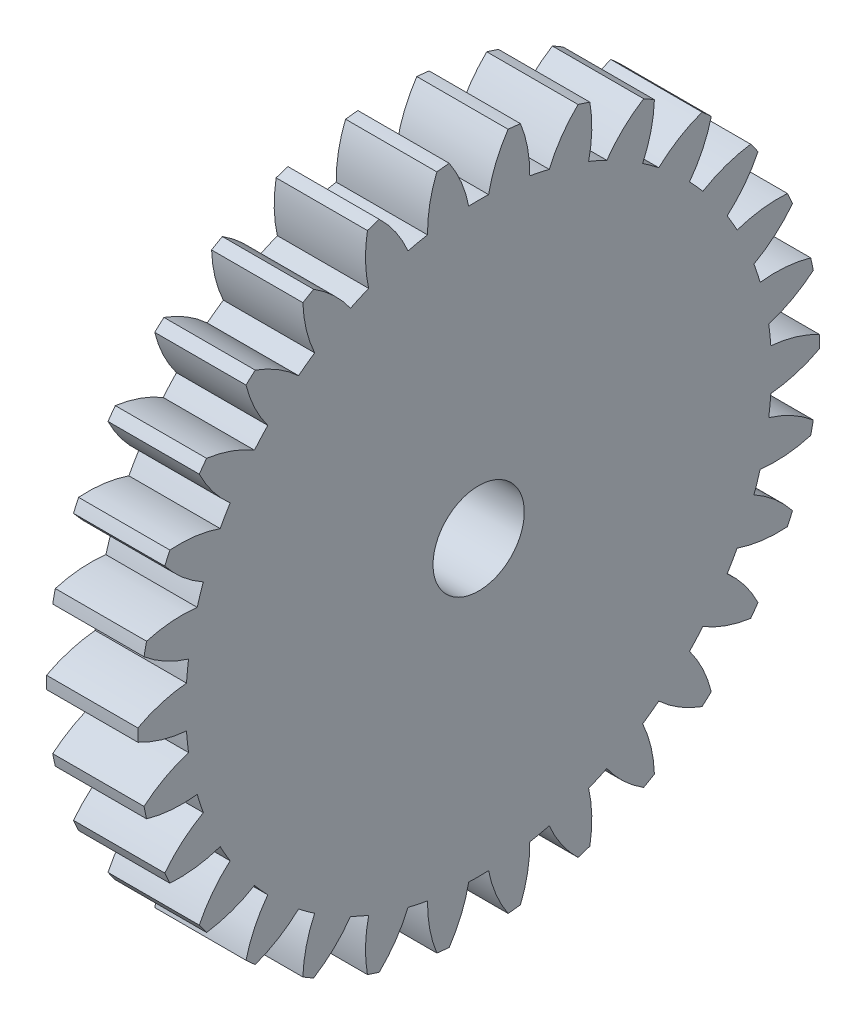
from build123d import *

# Parameters (mm, degrees)
BASPROSKE_W     = 3
BASPROSKE_H     = 11.2
TOOTHCUT_DEPTH  = 17.120794025
TEETHCUTS_COUNT = 30
TEETHCUTS_ANGLE = 348
BORSKE_R        = 1.5
BORE_DEPTH      = 50.0000508


with BuildPart() as part:
    # BasProSke → Base-Revolve (revolve)
    with BuildSketch(Plane(origin=(0, 0, 0), x_dir=(1, 0, 0), z_dir=(0, 1, 0)), mode=Mode.PRIVATE) as base_revolve_sk:
        with Locations((1.5, 5.6)):
            Rectangle(BASPROSKE_W, BASPROSKE_H)
    revolve(base_revolve_sk.sketch.rotate(Axis((-10, 0, 0), (1, 0, 0)), 180), axis=Axis((-10, 0, 0), (1, 0, 0)))

    # TooCutSke → ToothCut (cut, through all)
    with BuildSketch(Plane(origin=(0, 0, 0), x_dir=(0, 0, -1), z_dir=(1, 0, 0))):
        with BuildLine():
            ThreePointArc((0.327063784, 9.618440897), (0, 9.624), (-0.327063784, 9.618440897))
            ThreePointArc((-0.327063784, 9.618440897), (-0.575727667, 10.433821081), (-0.983909228, 11.182196913))
            ThreePointArc((-0.983909228, 11.182196913), (0, 11.2254), (0.983909228, 11.182196913))
            ThreePointArc((0.983909228, 11.182196913), (0.575727667, 10.433821081), (0.327063784, 9.618440897))
        make_face()
    toothcut = extrude(amount=TOOTHCUT_DEPTH, mode=Mode.SUBTRACT)

    # TeethCuts: ToothCut ×30 about axis
    teethcuts_axis = Axis((-10, 0, 0), (1, 0, 0))
    for i in range(1, TEETHCUTS_COUNT):
        add(toothcut.rotate(teethcuts_axis, i * TEETHCUTS_ANGLE / (TEETHCUTS_COUNT - 1)), mode=Mode.SUBTRACT)

    # BorSke → Bore (cut, symmetric)
    with BuildSketch(Plane(origin=(0, 0, 0), x_dir=(0, 0, -1), z_dir=(1, 0, 0))):
        with Locations(Location((0, 0, 0), (0, 0, 180))):
            Circle(BORSKE_R)
    extrude(amount=BORE_DEPTH, both=True, mode=Mode.SUBTRACT)


solid = part.part
